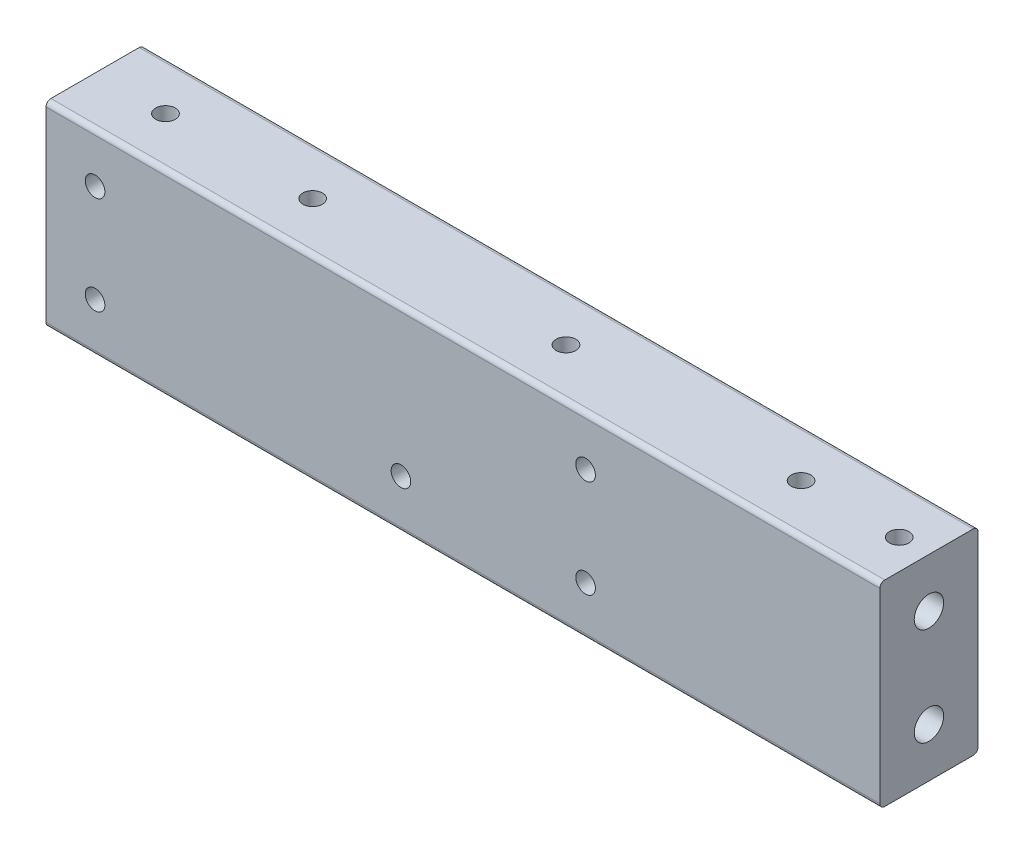
from build123d import *

# Parameters (mm, degrees)
SKETCH_1_W          = 170
SKETCH_1_H          = 40
EXTRUDE_1_DEPTH     = 20
FILLET_1_R          = 1
SKETCH_2_R          = 3
CUT_EXTRUDE_1_DEPTH = 176.783958312
SKETCH_3_R          = 2
CUT_EXTRUDE_2_DEPTH = 20
SKETCH_4_R          = 2
CUT_EXTRUDE_3_DEPTH = 20
SKETCH_5_R          = 2
CUT_EXTRUDE_4_DEPTH = 40


with BuildPart() as part:
    # 草图1 → 凸台-拉伸1 (new body)
    with BuildSketch(Plane.XY):
        with Locations((85, 20)):
            Rectangle(SKETCH_1_W, SKETCH_1_H)
    extrude(amount=EXTRUDE_1_DEPTH)

    # 圆角1
    fillet_1_edges = [part.edges().sort_by_distance(p)[0] for p in [
        (85, 40, 20),
        (85, 40, 0),
        (85, 0, 0),
        (85, 0, 20),
    ]]
    fillet(fillet_1_edges, radius=FILLET_1_R)

    # 草图2 → 切除-拉伸1 (cut, through all)
    with BuildSketch(Plane.ZY):
        with Locations((10, 30)):
            Circle(SKETCH_2_R)
        with Locations((10, 10)):
            Circle(SKETCH_2_R)
    extrude(amount=-CUT_EXTRUDE_1_DEPTH, mode=Mode.SUBTRACT)

    # 草图3 → 切除-拉伸2 (cut)
    with BuildSketch(Plane.XY.offset(20)):
        with Locations((10, 30)):
            Circle(SKETCH_3_R)
        with Locations((10, 10)):
            Circle(SKETCH_3_R)
        with Locations((110, 30)):
            Circle(SKETCH_3_R)
        with Locations((110, 10)):
            Circle(SKETCH_3_R)
    extrude(amount=-CUT_EXTRUDE_2_DEPTH, mode=Mode.SUBTRACT)

    # 草图4 → 切除-拉伸3 (cut)
    with BuildSketch(Plane.XY.offset(20)):
        with Locations((72.355339059, 10)):
            Circle(SKETCH_4_R)
    extrude(amount=-CUT_EXTRUDE_3_DEPTH, mode=Mode.SUBTRACT)

    # 草图5 → 切除-拉伸4 (cut)
    with BuildSketch(Plane(origin=(0, 40, 0), x_dir=(1, 0, 0), z_dir=(0, 1, 0))):
        with Locations(Location((96, -10, 0), (0, 0, 270))):
            Circle(SKETCH_5_R)
        with Locations(Location((143.92812266, -10, 0), (0, 0, 270))):
            Circle(SKETCH_5_R)
        with Locations(Location((163.932172008, -10, 0), (0, 0, 270))):
            Circle(SKETCH_5_R)
        with Locations(Location((14.355339059, -10, 0), (0, 0, 270))):
            Circle(SKETCH_5_R)
        with Locations(Location((44.355339059, -10, 0), (0, 0, 270))):
            Circle(SKETCH_5_R)
    extrude(amount=-CUT_EXTRUDE_4_DEPTH, mode=Mode.SUBTRACT)


solid = part.part
